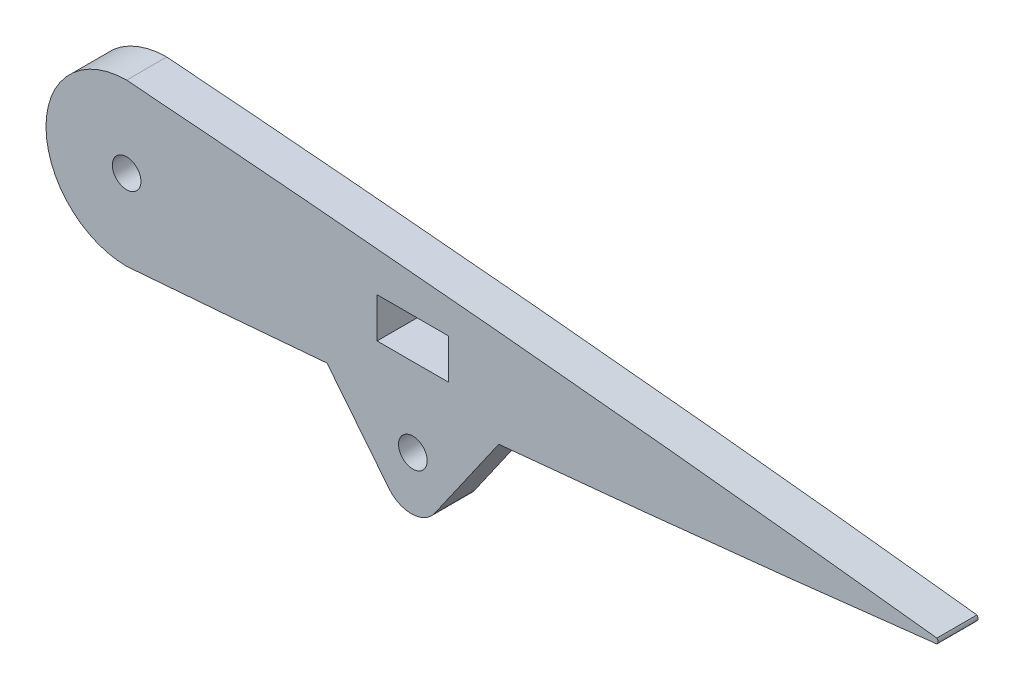
from build123d import *

# Parameters (mm, degrees)
SKETCH_1_R      = 1
SKETCH_1_W      = 5
SKETCH_1_H      = 2.8
EXTRUDE_1_DEPTH = 1.4


with BuildPart() as part:
    # Эскиз1 → Бобышка-Вытянуть1 (new, symmetric)
    with BuildSketch(Plane.XY):
        with BuildLine():
            ThreePointArc((223.382624747, 5.634990628), (219.398084745, 3.984540168), (217.747634119, 2.35e-07))
            ThreePointArc((217.747634119, 2.35e-07), (219.398084579, -3.984540002), (223.382624747, -5.634990628))
            add(Edge.make_bspline(
                [(223.382624746, -5.634990613), (224.328656864, -5.56201019), (226.923894547, -5.35916654), (231.150377303, -5.017351086), (234.870714804, -4.704112055), (236.94221324, -4.525459463), (237.382624747, -4.487285848)],
                knots=[0.670161589, 0.670161589, 0.670161589, 0.670161589, 0.686667237, 0.715444849, 0.743923546, 0.751613474, 0.751613474, 0.751613474, 0.751613474], degree=3))
            Line((237.382624747, -4.487285848), (241.711684424, -9.907783831))
            ThreePointArc((241.711684424, -9.907783831), (243.33918669, -10.658636419), (244.914699501, -9.80405897))
            Line((244.914699501, -9.80405897), (249.382624747, -3.400128388))
            add(Edge.make_bspline(
                [(249.382624747, -3.400128388), (251.158571989, -3.232274224), (254.371192488, -2.923000161), (258.952644662, -2.467188138), (263.047743378, -2.047856604), (266.898988862, -1.642607304), (270.455833183, -1.258590905), (273.651166984, -0.905304265), (276.385426802, -0.596436482), (278.45259621, -0.358958361), (279.592043704, -0.226075898), (280, -0.1785)],
                knots=[0.821480844, 0.821480844, 0.821480844, 0.821480844, 0.852512115, 0.877624446, 0.901571134, 0.924121062, 0.944988816, 0.963803939, 0.980044339, 0.992855276, 1, 1, 1, 1], degree=3))
            ThreePointArc((280, -0.1785), (280.073937121, 0), (280, 0.1785))
            add(Edge.make_bspline(
                [(280, 0.1785), (279.592043704, 0.226075898), (278.45259621, 0.358958361), (276.385426802, 0.596436482), (273.651166984, 0.905304265), (270.455833183, 1.258590905), (266.898988862, 1.642607304), (263.047743378, 2.047856604), (258.952644662, 2.467188138), (253.116111921, 3.047869044), (247.071089236, 3.62220531), (240.854179313, 4.184912649), (236.038226964, 4.605811749), (231.150377303, 5.017351103), (226.923894547, 5.359166556), (224.328656864, 5.562010205), (223.382624747, 5.634990628)],
                knots=[0, 0, 0, 0, 0.007144724, 0.019955661, 0.036196061, 0.055011184, 0.075878938, 0.098428866, 0.122375554, 0.147487885, 0.200459747, 0.22800517, 0.256076454, 0.284555151, 0.313332763, 0.329838411, 0.329838411, 0.329838411, 0.329838411], degree=3))
        make_face()
        with Locations((243.382624747, -6.903125596)):
            Circle(SKETCH_1_R, mode=Mode.SUBTRACT)
        with Locations((223.382624747, 0)):
            Circle(SKETCH_1_R, mode=Mode.SUBTRACT)
        with Locations((243.382624747, 0)):
            Rectangle(SKETCH_1_W, SKETCH_1_H, mode=Mode.SUBTRACT)
    extrude(amount=EXTRUDE_1_DEPTH, both=True)


solid = part.part
